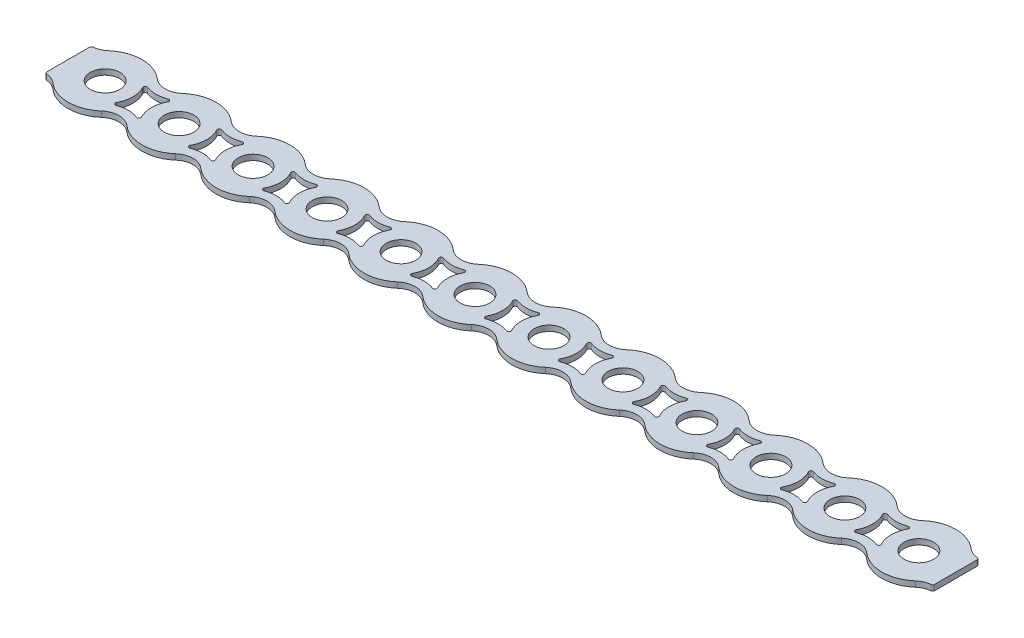
from build123d import *

# Parameters (mm, degrees)
SKETCH1_R           = 1.6
BOSS_EXTRUDE1_DEPTH = 0.6
CUT_EXTRUDE1_DEPTH  = 97.085170552
FILLET1_R           = 0.2


with BuildPart() as part:
    # Sketch1 → Boss-Extrude1 (new body)
    with BuildSketch(Plane(origin=(0, 0, 0), x_dir=(1, 0, 0), z_dir=(0, 1, 0))):
        with BuildLine():
            ThreePointArc((1.369863014, 3.01369863), (0.73150717, 2.632647547), (0, 2.5))
            Line((0, 2.5), (0, -2.5))
            ThreePointArc((0, -2.5), (0.73150717, -2.632647547), (1.369863014, -3.01369863))
            ThreePointArc((1.369863014, -3.01369863), (4, -4), (6.630136986, -3.01369863))
            ThreePointArc((6.630136986, -3.01369863), (7.26849283, -2.632647547), (8, -2.5))
            ThreePointArc((8, -2.5), (8.73150717, -2.632647547), (9.369863014, -3.01369863))
            ThreePointArc((9.369863014, -3.01369863), (12, -4), (14.630136986, -3.01369863))
            ThreePointArc((14.630136986, -3.01369863), (15.26849283, -2.632647547), (16, -2.5))
            ThreePointArc((16, -2.5), (16.73150717, -2.632647547), (17.369863014, -3.01369863))
            ThreePointArc((17.369863014, -3.01369863), (20, -4), (22.630136986, -3.01369863))
            ThreePointArc((22.630136986, -3.01369863), (23.26849283, -2.632647547), (24, -2.5))
            ThreePointArc((24, -2.5), (24.73150717, -2.632647547), (25.369863014, -3.01369863))
            ThreePointArc((25.369863014, -3.01369863), (28, -4), (30.630136986, -3.01369863))
            ThreePointArc((30.630136986, -3.01369863), (31.26849283, -2.632647547), (32, -2.5))
            ThreePointArc((32, -2.5), (32.73150717, -2.632647547), (33.369863014, -3.01369863))
            ThreePointArc((33.369863014, -3.01369863), (36, -4), (38.630136986, -3.01369863))
            ThreePointArc((38.630136986, -3.01369863), (39.26849283, -2.632647547), (40, -2.5))
            ThreePointArc((40, -2.5), (40.73150717, -2.632647547), (41.369863014, -3.01369863))
            ThreePointArc((41.369863014, -3.01369863), (44, -4), (46.630136986, -3.01369863))
            ThreePointArc((46.630136986, -3.01369863), (47.26849283, -2.632647547), (48, -2.5))
            ThreePointArc((48, -2.5), (48.73150717, -2.632647547), (49.369863014, -3.01369863))
            ThreePointArc((49.369863014, -3.01369863), (52, -4), (54.630136986, -3.01369863))
            ThreePointArc((54.630136986, -3.01369863), (55.26849283, -2.632647547), (56, -2.5))
            ThreePointArc((56, -2.5), (56.73150717, -2.632647547), (57.369863014, -3.01369863))
            ThreePointArc((57.369863014, -3.01369863), (60, -4), (62.630136986, -3.01369863))
            ThreePointArc((62.630136986, -3.01369863), (63.26849283, -2.632647547), (64, -2.5))
            ThreePointArc((64, -2.5), (64.73150717, -2.632647547), (65.369863014, -3.01369863))
            ThreePointArc((65.369863014, -3.01369863), (68, -4), (70.630136986, -3.01369863))
            ThreePointArc((70.630136986, -3.01369863), (71.26849283, -2.632647547), (72, -2.5))
            ThreePointArc((72, -2.5), (72.73150717, -2.632647547), (73.369863014, -3.01369863))
            ThreePointArc((73.369863014, -3.01369863), (76, -4), (78.630136986, -3.01369863))
            ThreePointArc((78.630136986, -3.01369863), (79.26849283, -2.632647547), (80, -2.5))
            ThreePointArc((80, -2.5), (80.73150717, -2.632647547), (81.369863014, -3.01369863))
            ThreePointArc((81.369863014, -3.01369863), (84, -4), (86.630136986, -3.01369863))
            ThreePointArc((86.630136986, -3.01369863), (87.26849283, -2.632647547), (88, -2.5))
            ThreePointArc((88, -2.5), (88.73150717, -2.632647547), (89.369863014, -3.01369863))
            ThreePointArc((89.369863014, -3.01369863), (92, -4), (94.630136986, -3.01369863))
            ThreePointArc((94.630136986, -3.01369863), (95.26849283, -2.632647547), (96, -2.5))
            Line((96, -2.5), (96, 2.5))
            ThreePointArc((96, 2.5), (95.26849283, 2.632647547), (94.630136986, 3.01369863))
            ThreePointArc((94.630136986, 3.01369863), (92, 4), (89.369863014, 3.01369863))
            ThreePointArc((89.369863014, 3.01369863), (88.73150717, 2.632647547), (88, 2.5))
            ThreePointArc((88, 2.5), (87.26849283, 2.632647547), (86.630136986, 3.01369863))
            ThreePointArc((86.630136986, 3.01369863), (84, 4), (81.369863014, 3.01369863))
            ThreePointArc((81.369863014, 3.01369863), (80.73150717, 2.632647547), (80, 2.5))
            ThreePointArc((80, 2.5), (79.26849283, 2.632647547), (78.630136986, 3.01369863))
            ThreePointArc((78.630136986, 3.01369863), (76, 4), (73.369863014, 3.01369863))
            ThreePointArc((73.369863014, 3.01369863), (72.73150717, 2.632647547), (72, 2.5))
            ThreePointArc((72, 2.5), (71.26849283, 2.632647547), (70.630136986, 3.01369863))
            ThreePointArc((70.630136986, 3.01369863), (68, 4), (65.369863014, 3.01369863))
            ThreePointArc((65.369863014, 3.01369863), (64.73150717, 2.632647547), (64, 2.5))
            ThreePointArc((64, 2.5), (63.26849283, 2.632647547), (62.630136986, 3.01369863))
            ThreePointArc((62.630136986, 3.01369863), (60, 4), (57.369863014, 3.01369863))
            ThreePointArc((57.369863014, 3.01369863), (56.73150717, 2.632647547), (56, 2.5))
            ThreePointArc((56, 2.5), (55.26849283, 2.632647547), (54.630136986, 3.01369863))
            ThreePointArc((54.630136986, 3.01369863), (52, 4), (49.369863014, 3.01369863))
            ThreePointArc((49.369863014, 3.01369863), (48.73150717, 2.632647547), (48, 2.5))
            ThreePointArc((48, 2.5), (47.26849283, 2.632647547), (46.630136986, 3.01369863))
            ThreePointArc((46.630136986, 3.01369863), (44, 4), (41.369863014, 3.01369863))
            ThreePointArc((41.369863014, 3.01369863), (40.73150717, 2.632647547), (40, 2.5))
            ThreePointArc((40, 2.5), (39.26849283, 2.632647547), (38.630136986, 3.01369863))
            ThreePointArc((38.630136986, 3.01369863), (36, 4), (33.369863014, 3.01369863))
            ThreePointArc((33.369863014, 3.01369863), (32.73150717, 2.632647547), (32, 2.5))
            ThreePointArc((32, 2.5), (31.26849283, 2.632647547), (30.630136986, 3.01369863))
            ThreePointArc((30.630136986, 3.01369863), (28, 4), (25.369863014, 3.01369863))
            ThreePointArc((25.369863014, 3.01369863), (24.73150717, 2.632647547), (24, 2.5))
            ThreePointArc((24, 2.5), (23.26849283, 2.632647547), (22.630136986, 3.01369863))
            ThreePointArc((22.630136986, 3.01369863), (20, 4), (17.369863014, 3.01369863))
            ThreePointArc((17.369863014, 3.01369863), (16.73150717, 2.632647547), (16, 2.5))
            ThreePointArc((16, 2.5), (15.26849283, 2.632647547), (14.630136986, 3.01369863))
            ThreePointArc((14.630136986, 3.01369863), (12, 4), (9.369863014, 3.01369863))
            ThreePointArc((9.369863014, 3.01369863), (8.73150717, 2.632647547), (8, 2.5))
            ThreePointArc((8, 2.5), (7.26849283, 2.632647547), (6.630136986, 3.01369863))
            ThreePointArc((6.630136986, 3.01369863), (4, 4), (1.369863014, 3.01369863))
        make_face()
        with Locations((4, 0)):
            Circle(SKETCH1_R, mode=Mode.SUBTRACT)
        with Locations((12, 0)):
            Circle(SKETCH1_R, mode=Mode.SUBTRACT)
        with Locations((20, 0)):
            Circle(SKETCH1_R, mode=Mode.SUBTRACT)
        with Locations((28, 0)):
            Circle(SKETCH1_R, mode=Mode.SUBTRACT)
        with Locations((36, 0)):
            Circle(SKETCH1_R, mode=Mode.SUBTRACT)
        with Locations((44, 0)):
            Circle(SKETCH1_R, mode=Mode.SUBTRACT)
        with Locations((52, 0)):
            Circle(SKETCH1_R, mode=Mode.SUBTRACT)
        with Locations((60, 0)):
            Circle(SKETCH1_R, mode=Mode.SUBTRACT)
        with Locations((68, 0)):
            Circle(SKETCH1_R, mode=Mode.SUBTRACT)
        with Locations((76, 0)):
            Circle(SKETCH1_R, mode=Mode.SUBTRACT)
        with Locations((84, 0)):
            Circle(SKETCH1_R, mode=Mode.SUBTRACT)
        with Locations((92, 0)):
            Circle(SKETCH1_R, mode=Mode.SUBTRACT)
    extrude(amount=BOSS_EXTRUDE1_DEPTH)

    # Sketch2 → Cut-Extrude1 (cut, through all)
    with BuildSketch(Plane(origin=(0, 0, 0), x_dir=(1, 0, 0), z_dir=(0, 1, 0))):
        with BuildLine():
            ThreePointArc((90.02739726, -2.260273973), (89, 0), (90.02739726, 2.260273973))
            ThreePointArc((90.02739726, 2.260273973), (88, 1.5), (85.97260274, 2.260273973))
            ThreePointArc((85.97260274, 2.260273973), (87, 0), (85.97260274, -2.260273973))
            ThreePointArc((85.97260274, -2.260273973), (88, -1.5), (90.02739726, -2.260273973))
        make_face()
        with BuildLine():
            ThreePointArc((82.02739726, -2.260273973), (81, 0), (82.02739726, 2.260273973))
            ThreePointArc((82.02739726, 2.260273973), (80, 1.5), (77.97260274, 2.260273973))
            ThreePointArc((77.97260274, 2.260273973), (79, 0), (77.97260274, -2.260273973))
            ThreePointArc((77.97260274, -2.260273973), (80, -1.5), (82.02739726, -2.260273973))
        make_face()
        with BuildLine():
            ThreePointArc((74.02739726, -2.260273973), (73, 0), (74.02739726, 2.260273973))
            ThreePointArc((74.02739726, 2.260273973), (72, 1.5), (69.97260274, 2.260273973))
            ThreePointArc((69.97260274, 2.260273973), (71, 0), (69.97260274, -2.260273973))
            ThreePointArc((69.97260274, -2.260273973), (72, -1.5), (74.02739726, -2.260273973))
        make_face()
        with BuildLine():
            ThreePointArc((66.02739726, -2.260273973), (65, 0), (66.02739726, 2.260273973))
            ThreePointArc((66.02739726, 2.260273973), (64, 1.5), (61.97260274, 2.260273973))
            ThreePointArc((61.97260274, 2.260273973), (63, 0), (61.97260274, -2.260273973))
            ThreePointArc((61.97260274, -2.260273973), (64, -1.5), (66.02739726, -2.260273973))
        make_face()
        with BuildLine():
            ThreePointArc((58.02739726, -2.260273973), (57, 0), (58.02739726, 2.260273973))
            ThreePointArc((58.02739726, 2.260273973), (56, 1.5), (53.97260274, 2.260273973))
            ThreePointArc((53.97260274, 2.260273973), (55, 0), (53.97260274, -2.260273973))
            ThreePointArc((53.97260274, -2.260273973), (56, -1.5), (58.02739726, -2.260273973))
        make_face()
        with BuildLine():
            ThreePointArc((50.02739726, -2.260273973), (49, 0), (50.02739726, 2.260273973))
            ThreePointArc((50.02739726, 2.260273973), (48, 1.5), (45.97260274, 2.260273973))
            ThreePointArc((45.97260274, 2.260273973), (47, 0), (45.97260274, -2.260273973))
            ThreePointArc((45.97260274, -2.260273973), (48, -1.5), (50.02739726, -2.260273973))
        make_face()
        with BuildLine():
            ThreePointArc((42.02739726, -2.260273973), (41, 0), (42.02739726, 2.260273973))
            ThreePointArc((42.02739726, 2.260273973), (40, 1.5), (37.97260274, 2.260273973))
            ThreePointArc((37.97260274, 2.260273973), (39, 0), (37.97260274, -2.260273973))
            ThreePointArc((37.97260274, -2.260273973), (40, -1.5), (42.02739726, -2.260273973))
        make_face()
        with BuildLine():
            ThreePointArc((34.02739726, -2.260273973), (33, 0), (34.02739726, 2.260273973))
            ThreePointArc((34.02739726, 2.260273973), (32, 1.5), (29.97260274, 2.260273973))
            ThreePointArc((29.97260274, 2.260273973), (31, 0), (29.97260274, -2.260273973))
            ThreePointArc((29.97260274, -2.260273973), (32, -1.5), (34.02739726, -2.260273973))
        make_face()
        with BuildLine():
            ThreePointArc((26.02739726, -2.260273973), (25, 0), (26.02739726, 2.260273973))
            ThreePointArc((26.02739726, 2.260273973), (24, 1.5), (21.97260274, 2.260273973))
            ThreePointArc((21.97260274, 2.260273973), (23, 0), (21.97260274, -2.260273973))
            ThreePointArc((21.97260274, -2.260273973), (24, -1.5), (26.02739726, -2.260273973))
        make_face()
        with BuildLine():
            ThreePointArc((18.02739726, -2.260273973), (17, 0), (18.02739726, 2.260273973))
            ThreePointArc((18.02739726, 2.260273973), (16, 1.5), (13.97260274, 2.260273973))
            ThreePointArc((13.97260274, 2.260273973), (15, 0), (13.97260274, -2.260273973))
            ThreePointArc((13.97260274, -2.260273973), (16, -1.5), (18.02739726, -2.260273973))
        make_face()
        with BuildLine():
            ThreePointArc((10.02739726, -2.260273973), (9, 0), (10.02739726, 2.260273973))
            ThreePointArc((10.02739726, 2.260273973), (8, 1.5), (5.97260274, 2.260273973))
            ThreePointArc((5.97260274, 2.260273973), (7, 0), (5.97260274, -2.260273973))
            ThreePointArc((5.97260274, -2.260273973), (8, -1.5), (10.02739726, -2.260273973))
        make_face()
    extrude(amount=CUT_EXTRUDE1_DEPTH, mode=Mode.SUBTRACT)

    # Fillet1
    fillet1_edges = [part.edges().sort_by_distance(p)[0] for p in [
        (0, 0.3, -2.5),
        (0, 0.3, 2.5),
        (85.97260274, 0.3, 2.260273973),
        (90.02739726, 0.3, 2.260273973),
        (90.02739726, 0.3, -2.260273973),
        (85.97260274, 0.3, -2.260273973),
        (37.97260274, 0.3, 2.260273973),
        (42.02739726, 0.3, 2.260273973),
        (42.02739726, 0.3, -2.260273973),
        (37.97260274, 0.3, -2.260273973),
        (21.97260274, 0.3, 2.260273973),
        (26.02739726, 0.3, 2.260273973),
        (26.02739726, 0.3, -2.260273973),
        (21.97260274, 0.3, -2.260273973),
        (5.97260274, 0.3, 2.260273973),
        (10.02739726, 0.3, 2.260273973),
        (10.02739726, 0.3, -2.260273973),
        (5.97260274, 0.3, -2.260273973),
        (61.97260274, 0.3, 2.260273973),
        (66.02739726, 0.3, 2.260273973),
        (66.02739726, 0.3, -2.260273973),
        (61.97260274, 0.3, -2.260273973),
        (77.97260274, 0.3, 2.260273973),
        (82.02739726, 0.3, 2.260273973),
        (82.02739726, 0.3, -2.260273973),
        (77.97260274, 0.3, -2.260273973),
        (96, 0.3, -2.5),
        (96, 0.3, 2.5),
        (69.97260274, 0.3, 2.260273973),
        (74.02739726, 0.3, 2.260273973),
        (74.02739726, 0.3, -2.260273973),
        (69.97260274, 0.3, -2.260273973),
        (53.97260274, 0.3, 2.260273973),
        (58.02739726, 0.3, 2.260273973),
        (58.02739726, 0.3, -2.260273973),
        (53.97260274, 0.3, -2.260273973),
        (13.97260274, 0.3, 2.260273973),
        (18.02739726, 0.3, 2.260273973),
        (18.02739726, 0.3, -2.260273973),
        (13.97260274, 0.3, -2.260273973),
        (29.97260274, 0.3, 2.260273973),
        (34.02739726, 0.3, 2.260273973),
        (34.02739726, 0.3, -2.260273973),
        (29.97260274, 0.3, -2.260273973),
        (45.97260274, 0.3, 2.260273973),
        (50.02739726, 0.3, 2.260273973),
        (50.02739726, 0.3, -2.260273973),
        (45.97260274, 0.3, -2.260273973),
    ]]
    fillet(fillet1_edges, radius=FILLET1_R)


solid = part.part
